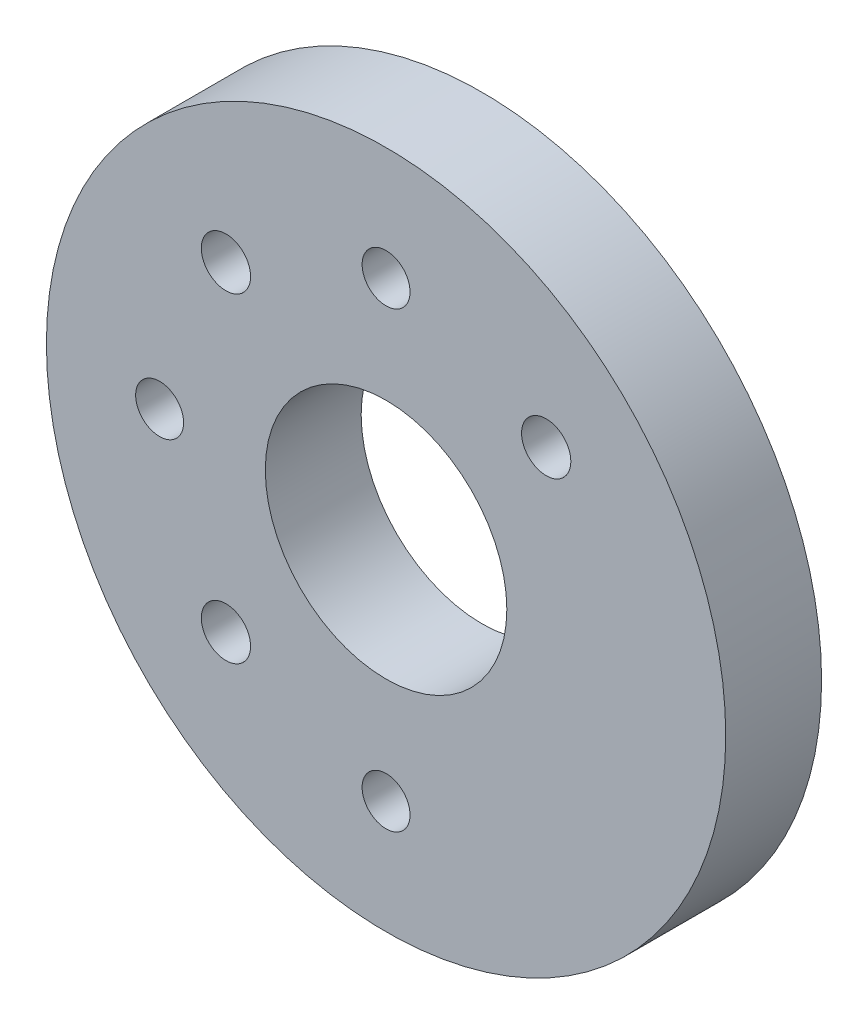
from build123d import *

# Parameters (mm, degrees)
SKETCH1_R           = 22.5
SKETCH1_R_2         = 8
SKETCH1_R_3         = 1.5875
SKETCH1_R_4         = 1.63195
BOSS_EXTRUDE1_DEPTH = 6.35


with BuildPart() as part:
    # Sketch1 → Boss-Extrude1 (new body)
    with BuildSketch(Plane.XY):
        Circle(SKETCH1_R)
        Circle(SKETCH1_R_2, mode=Mode.SUBTRACT)
        with Locations((0, 15)):
            Circle(SKETCH1_R_3, mode=Mode.SUBTRACT)
        with Locations((0, -15)):
            Circle(SKETCH1_R_3, mode=Mode.SUBTRACT)
        with Locations((-15, 0)):
            Circle(SKETCH1_R_3, mode=Mode.SUBTRACT)
        with Locations((-10.606601718, 10.606601718)):
            Circle(SKETCH1_R_4, mode=Mode.SUBTRACT)
        with Locations((10.606601718, 10.606601718)):
            Circle(SKETCH1_R_4, mode=Mode.SUBTRACT)
        with Locations((-10.606601718, -10.606601718)):
            Circle(SKETCH1_R_4, mode=Mode.SUBTRACT)
    extrude(amount=BOSS_EXTRUDE1_DEPTH)


solid = part.part
